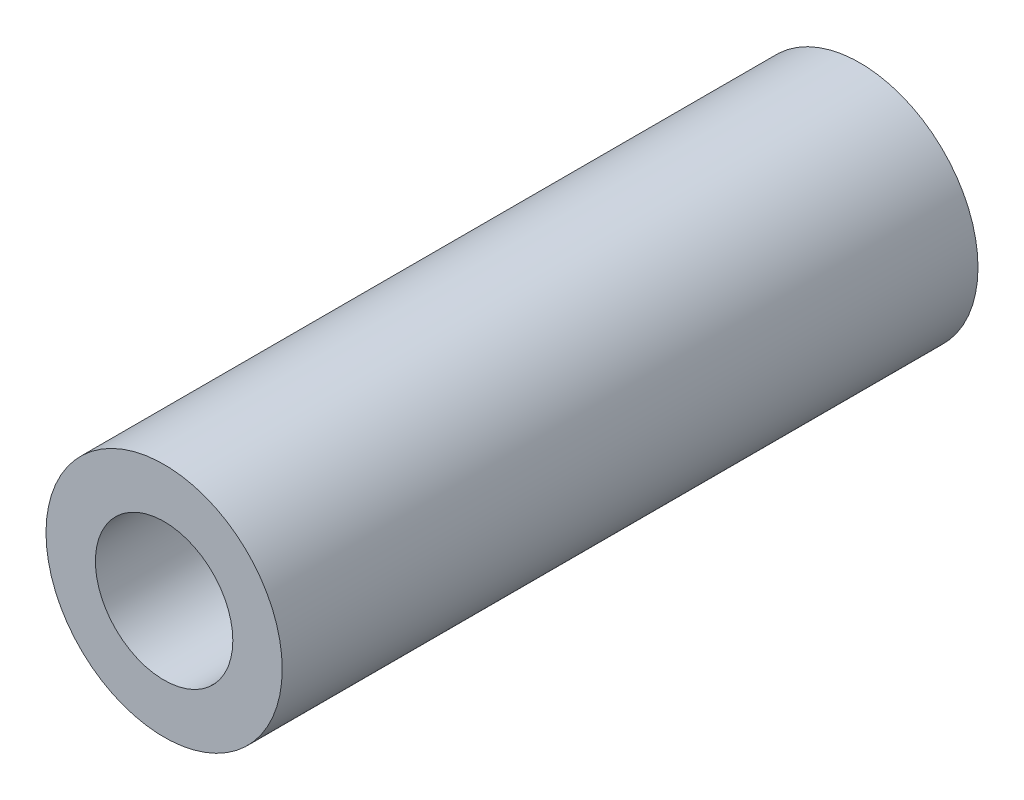
from build123d import *

# Parameters (mm, degrees)
SKETCH_1_R      = 2.75
SKETCH_1_R_2    = 1.6
EXTRUDE_1_DEPTH = 16.2


with BuildPart() as part:
    # ｽｹｯﾁ1 → ﾎﾞｽ - 押し出し1 (new body)
    with BuildSketch(Plane.XY):
        Circle(SKETCH_1_R)
        Circle(SKETCH_1_R_2, mode=Mode.SUBTRACT)
    extrude(amount=EXTRUDE_1_DEPTH)


solid = part.part
